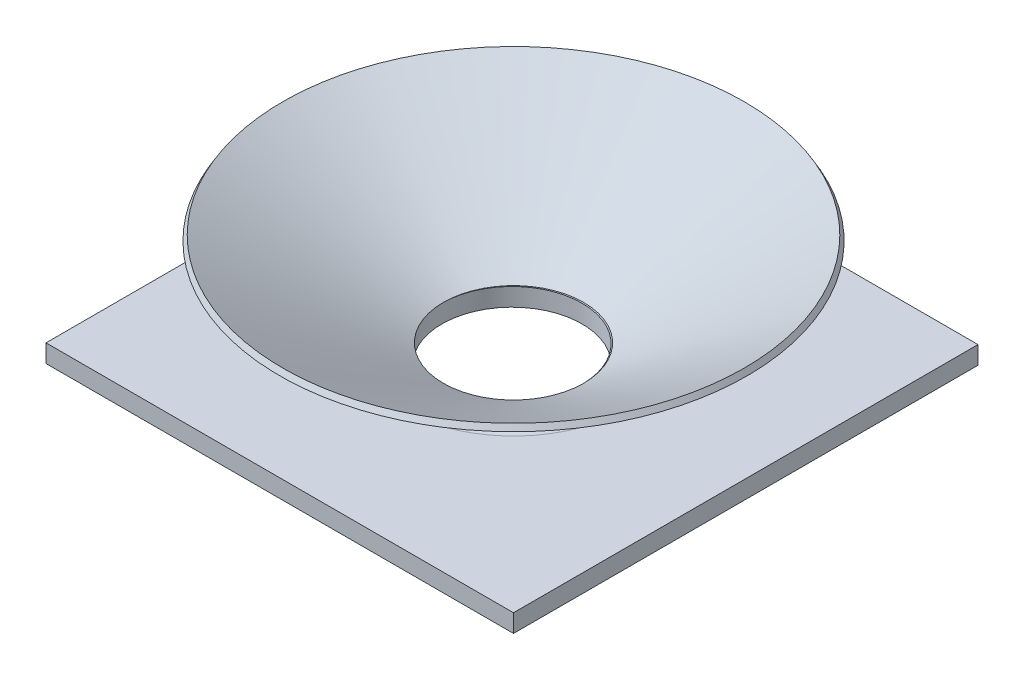
from build123d import *

# Parameters (mm, degrees)
SKETCH2_W           = 78.15
SKETCH2_H           = 77.647079997
SKETCH2_R           = 11.72
BOSS_EXTRUDE1_DEPTH = 3


with BuildPart() as part:
    # Sketch1 → Revolve1 (revolve)
    with BuildSketch(Plane.XY, mode=Mode.PRIVATE) as revolve1_sk:
        Polygon((-13.706887802, 0), (-39.075, 14.760667037), (-38.572079997, 15.625), (-11.7185, 0), align=None)
    revolve(revolve1_sk.sketch.rotate(Axis((0, 0, 0), (0, 1, 0)), 270), axis=Axis((0, 0, 0), (0, 1, 0)))



with BuildPart() as body_2:
    # Sketch2 → Boss-Extrude1 (new body)
    with BuildSketch(Plane(origin=(0, 0, 0), x_dir=(1, 0, 0), z_dir=(0, 1, 0))):
        with Locations((0, -0.251460001)):
            Rectangle(SKETCH2_W, SKETCH2_H)
        with Locations(Location((0, -0.251460002, 0), (0, 0, 270))):
            Circle(SKETCH2_R, mode=Mode.SUBTRACT)
    extrude(amount=-BOSS_EXTRUDE1_DEPTH)


with BuildPart() as part_1:
    add(part.part)

    add(body_2.part)  # Revolve2 merges body 2
    # Sketch3 → Revolve2 (revolve)
    with BuildSketch(Plane.XY, mode=Mode.PRIVATE) as revolve2_sk:
        with BuildLine():
            Line((-13.706887802, 0), (-18.360981068, 2.708026538))
            ThreePointArc((-18.360981068, 2.708026538), (-17.68908093, 1.074231171), (-19.091494738, 0))
            Line((-19.091494738, 0), (-13.706887802, 0))
        make_face()
    revolve(revolve2_sk.sketch.rotate(Axis((0, 0, 0), (0, 1, 0)), 270), axis=Axis((0, 0, 0), (0, 1, 0)))


solid = part_1.part
